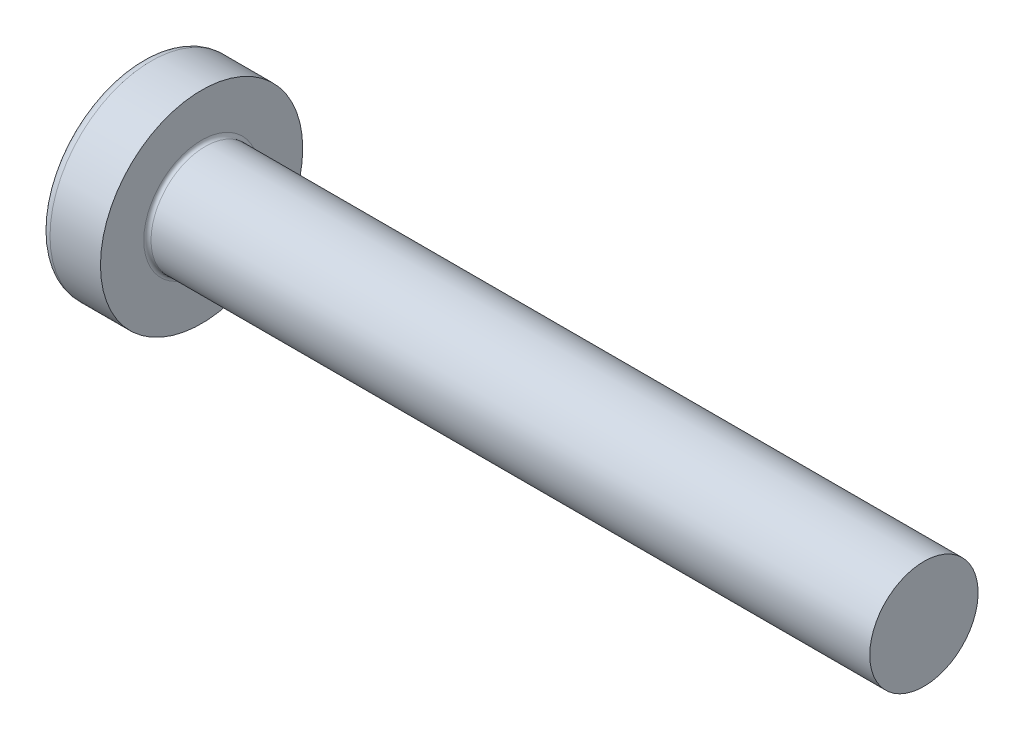
from build123d import *

# Parameters (mm, degrees)
FILLET1_R    = 0.1
RECPAT_COUNT = 2
RECPAT_ANGLE = 90


with BuildPart() as part:
    # BodySke → Base-Revolve (revolve)
    with BuildSketch(Plane.XY, mode=Mode.PRIVATE) as base_revolve_sk:
        with BuildLine():
            Line((2.4, 1.5), (2.4, 2.8))
            Line((2.4, 2.8), (1.003501533, 2.8))
            ThreePointArc((1.003501533, 2.8), (0.873295971, 2.76653015), (0.775371599, 2.674418605))
            ThreePointArc((0.775371599, 2.674418605), (0.197753546, 1.392274756), (0, 0))
            Line((0, 0), (22.4, 0))
            Line((22.4, 0), (22.4, 1.5))
            Line((22.4, 1.5), (2.4, 1.5))
        make_face()
    revolve(base_revolve_sk.sketch.rotate(Axis((1.003501533, 0, 0), (1, 0, 0)), 90), axis=Axis((1.003501533, 0, 0), (1, 0, 0)))

    # Fillet1
    fillet1_edges = [part.edges().sort_by_distance(p)[0] for p in [
        (2.4, 0, -1.5),
    ]]
    fillet(fillet1_edges, radius=FILLET1_R)

    # Sketch3 → Recess section 0
    with BuildSketch(Plane(origin=(0, 0, 0), x_dir=(0, 0, -1), z_dir=(1, 0, 0))):
        with BuildLine():
            Line((0.37, -1.4), (-0.37, -1.4))
            Line((-0.37, -1.4), (-0.37, 1.4))
            Line((-0.37, 1.4), (0.37, 1.4))
            Line((0.37, 1.4), (0.37, -1.4))
        make_face()
    # Sketch4 → Recess section 1
    with BuildSketch(Plane(origin=(1.75, 0, 0), x_dir=(0, 0, -1), z_dir=(1, 0, 0))):
        with BuildLine():
            Line((0.37, -0.527482216), (-0.37, -0.527482216))
            Line((-0.37, -0.527482216), (-0.37, 0.527482216))
            Line((-0.37, 0.527482216), (0.37, 0.527482216))
            Line((0.37, 0.527482216), (0.37, -0.527482216))
        make_face()
    recess = loft(mode=Mode.SUBTRACT)

    # RecPat: Recess ×2 about axis
    recpat_axis = Axis((0, 0, 0), (1, 0, 0))
    for i in range(1, RECPAT_COUNT):
        add(recess.rotate(recpat_axis, i * RECPAT_ANGLE / (RECPAT_COUNT - 1)), mode=Mode.SUBTRACT)

    # RecCorSke → RecessCore (revolve, cut)
    with BuildSketch(Plane.XY, mode=Mode.PRIVATE) as recesscore_sk:
        Polygon((0, 0), (0, 0.678371921), (1.75, 0.556), (1.930655351, 0), align=None)
    revolve(recesscore_sk.sketch.rotate(Axis((-3.175, 0, 0), (1, 0, 0)), 344.185974236), axis=Axis((-3.175, 0, 0), (1, 0, 0)), mode=Mode.SUBTRACT)


solid = part.part
